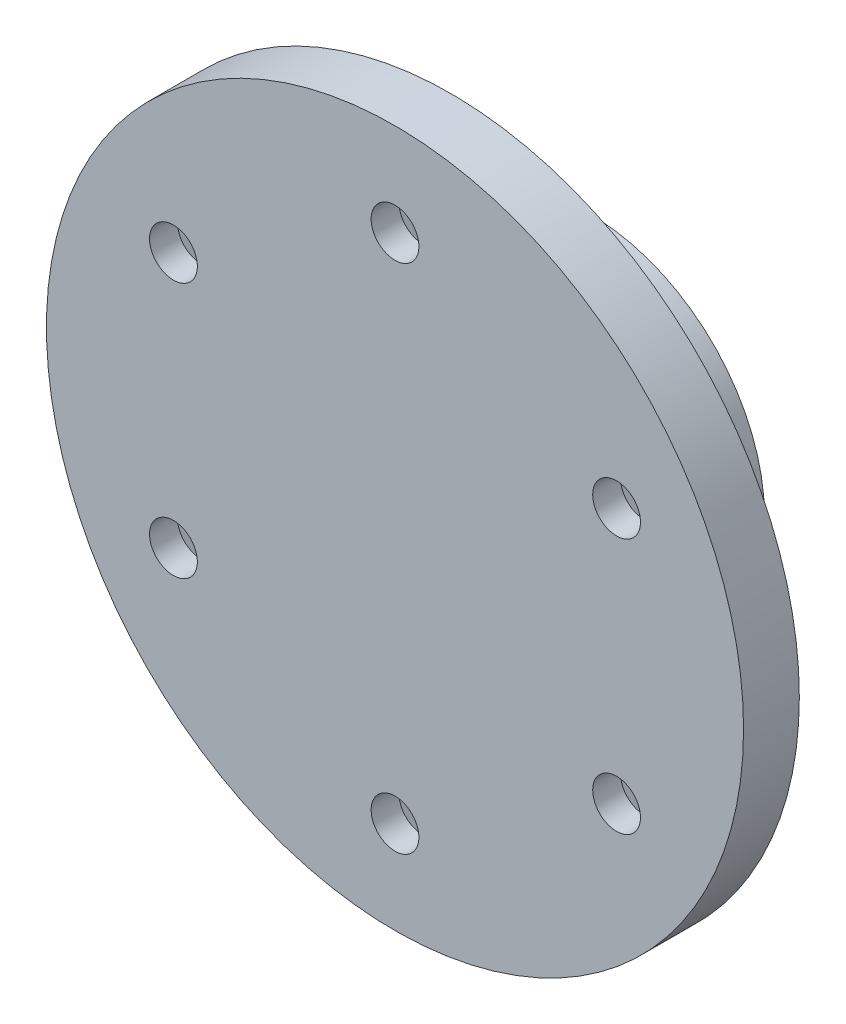
from build123d import *

# Parameters (mm, degrees)
SKETCH1_R           = 25
BOSS_EXTRUDE1_DEPTH = 4
SKETCH2_R           = 1.713577746
CUT_EXTRUDE1_DEPTH  = 4
CUT_EXTRUDE2_DEPTH  = 2
SKETCH4_R           = 12.5
SKETCH4_R_2         = 3
BOSS_EXTRUDE2_DEPTH = 10
SKETCH5_R           = 1.6
CUT_EXTRUDE3_DEPTH  = 12.5
SKETCH6_R           = 3.1
CUT_EXTRUDE4_DEPTH  = 6
CUT_EXTRUDE5_DEPTH  = 3
FILLET1_R           = 1.5


with BuildPart() as part:
    # Sketch1 → Boss-Extrude1 (new body)
    with BuildSketch(Plane.XY):
        Circle(SKETCH1_R)
    extrude(amount=BOSS_EXTRUDE1_DEPTH)

    # Sketch2 → Cut-Extrude1 (cut)
    with BuildSketch(Plane(origin=(0, 0, 0), x_dir=(-1, 0, 0), z_dir=(0, 0, -1))):
        with Locations((0, 18.35)):
            Circle(SKETCH2_R)
        with Locations((15.891566159, 9.175)):
            Circle(SKETCH2_R)
        with Locations((15.891566159, -9.175)):
            Circle(SKETCH2_R)
        with Locations((0, -18.35)):
            Circle(SKETCH2_R)
        with Locations((-15.891566159, -9.175)):
            Circle(SKETCH2_R)
        with Locations((-15.891566159, 9.175)):
            Circle(SKETCH2_R)
    extrude(amount=-CUT_EXTRUDE1_DEPTH, mode=Mode.SUBTRACT)

    # Sketch3 → Cut-Extrude2 (cut)
    with BuildSketch(Plane(origin=(0, 0, 0), x_dir=(-1, 0, 0), z_dir=(0, 0, -1))):
        Polygon((13.870840217, 5.675), (17.912292102, 5.675), (19.933018044, 9.175), (17.912292102, 12.675), (13.870840217, 12.675), (11.850114275, 9.175), align=None)
        Polygon((4.041451884, 18.35), (2.020725942, 21.85), (-2.020725942, 21.85), (-4.041451884, 18.35), (-2.020725942, 14.85), (2.020725942, 14.85), align=None)
        Polygon((11.850114275, -9.175), (13.870840217, -12.675), (17.912292102, -12.675), (19.933018044, -9.175), (17.912292102, -5.675), (13.870840217, -5.675), align=None)
        Polygon((-2.020725942, -14.85), (-4.041451884, -18.35), (-2.020725942, -21.85), (2.020725942, -21.85), (4.041451884, -18.35), (2.020725942, -14.85), align=None)
        Polygon((-13.870840217, -5.675), (-17.912292102, -5.675), (-19.933018044, -9.175), (-17.912292102, -12.675), (-13.870840217, -12.675), (-11.850114275, -9.175), align=None)
        Polygon((-11.850114275, 9.175), (-13.870840217, 12.675), (-17.912292102, 12.675), (-19.933018044, 9.175), (-17.912292102, 5.675), (-13.870840217, 5.675), align=None)
    extrude(amount=-CUT_EXTRUDE2_DEPTH, mode=Mode.SUBTRACT)

    # Sketch4 → Boss-Extrude2 (add)
    with BuildSketch(Plane(origin=(0, 0, 0), x_dir=(-1, 0, 0), z_dir=(0, 0, -1))):
        with Locations(Location((0, 0, 0), (0, 0, 180))):
            Circle(SKETCH4_R)
        with Locations((0, 1)):
            Circle(SKETCH4_R_2, mode=Mode.SUBTRACT)
    extrude(amount=BOSS_EXTRUDE2_DEPTH)

    # Sketch5 → Cut-Extrude3 (cut)
    with BuildSketch(Plane(origin=(0, 12.5, 0), x_dir=(1, 0, 0), z_dir=(0, 1, 0))):
        with Locations(Location((0, 5, 0), (0, 0, 270))):
            Circle(SKETCH5_R)
    extrude(amount=-CUT_EXTRUDE3_DEPTH, mode=Mode.SUBTRACT)

    # Sketch6 → Cut-Extrude4 (cut)
    with BuildSketch(Plane(origin=(0, 12.5, 0), x_dir=(1, 0, 0), z_dir=(0, 1, 0))):
        with Locations(Location((0, 5, 0), (0, 0, 270))):
            Circle(SKETCH6_R)
    extrude(amount=-CUT_EXTRUDE4_DEPTH, mode=Mode.SUBTRACT)

    # Sketch7 → Cut-Extrude5 (cut)
    with BuildSketch(Plane(origin=(0, 1.5, 0), x_dir=(1, 0, 0), z_dir=(0, 1, 0))):
        Polygon((2.174315781, 7.9), (-12.5, 7.9), (-12.5, 2.1), (2.174315781, 2.1), (3.848631561, 5), align=None)
    extrude(amount=CUT_EXTRUDE5_DEPTH, mode=Mode.SUBTRACT)

    # Fillet1
    fillet1_edges = [part.edges().sort_by_distance(p)[0] for p in [
        (-12.5, 0, 0),
    ]]
    fillet(fillet1_edges, radius=FILLET1_R)


solid = part.part
